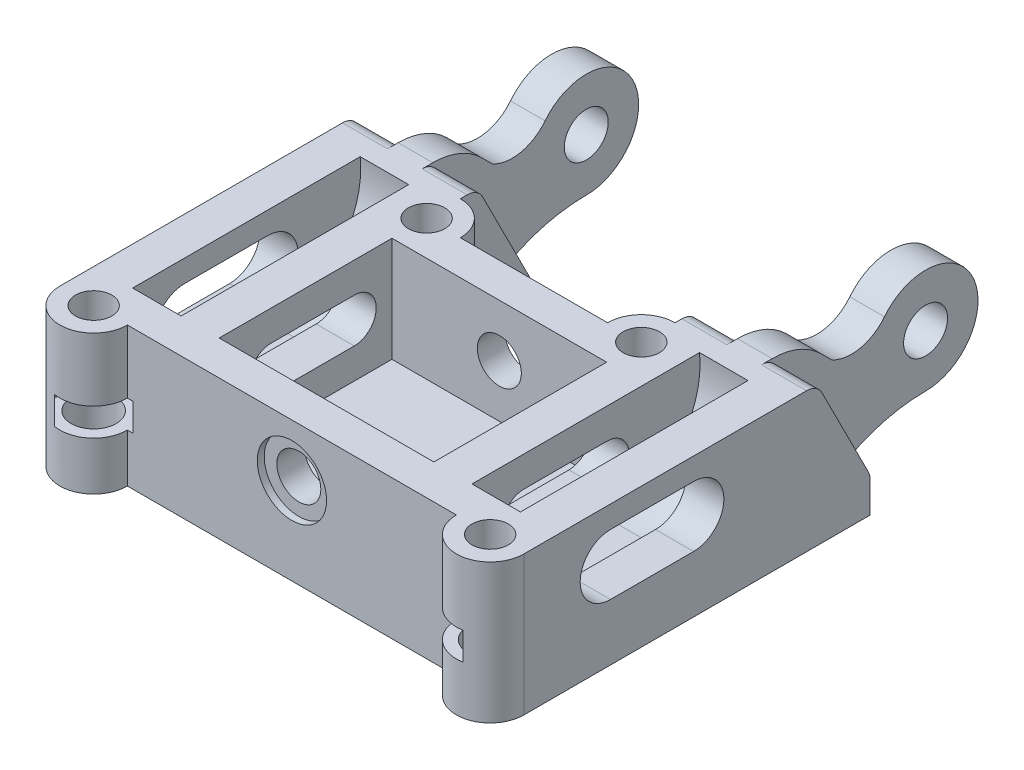
from build123d import *
from build123d.topology import SkipClean

# Parameters (mm, degrees)
SKETCH1_R                = 3.175
BOSS_EXTRUDE1_DEPTH      = 18
CUT_EXTRUDE4_DEPTH       = 3.5
CUT_EXTRUDE4_DEPTH_BACK  = 3.5
CUT_EXTRUDE5_DEPTH       = 6.5
SKETCH9_W                = 50
SKETCH9_H                = 5
BOSS_EXTRUDE2_DEPTH      = 15.5
FILLET8_R                = 2.5
BOSS_EXTRUDE3_REACH      = 75.76
SKETCH13_W               = 5
SKETCH13_H               = 15.14
SKETCH16_W               = 15.5
SKETCH16_H               = 5
BOSS_EXTRUDE4_DEPTH      = 15.14
CUT_EXTRUDE8_REACH       = 77.34
CUT_EXTRUDE9_DEPTH       = 5.5
CUT_EXTRUDE10_DEPTH      = 1
CUT_EXTRUDE11_START      = -1
SKETCH20_R               = 5
CUT_EXTRUDE11_DEPTH      = 1
SKETCH21_W               = 31
SKETCH21_H               = 15.05
CUT_EXTRUDE12_DEPTH      = 5
BOSS_EXTRUDE11_DEPTH     = 20.14
SKETCH31_R               = 2.125
CUT_EXTRUDE16_DEPTH      = 20.14
SKETCH38_R               = 3.25
CUT_EXTRUDE19_DEPTH      = 8
CUT_EXTRUDE21_DEPTH      = 3
CUT_EXTRUDE21_DEPTH_BACK = 1
SKETCH39_R               = 2.625
M5_CUT_DEPTH             = 9.14


with BuildPart() as part:
    # Sketch1 → Boss-Extrude1 (new body)
    with BuildSketch(Plane(origin=(0, 0, 0), x_dir=(0, 0, -1), z_dir=(1, 0, 0))):
        with BuildLine():
            Line((-64.5, -12.57), (-14.5, -12.57))
            ThreePointArc((-14.5, -12.57), (-7.668930825, -8.855100607), (0, -7.57))
            ThreePointArc((0, -7.57), (6.813585795, 3.298476711), (-5.937768577, 4.695508953))
            ThreePointArc((-5.937768577, 4.695508953), (-9.447591416, 2.520990205), (-13.536399337, 3.094608482))
            Line((-13.536399337, 3.094608482), (-15.082858667, 4.641067812))
            ThreePointArc((-15.082858667, 4.641067812), (-18.327092155, 6.808795325), (-22.153926479, 7.57))
            Line((-22.153926479, 7.57), (-24.481144331, 7.57))
            Line((-24.481144331, 7.57), (-64.5, 7.57))
            Line((-64.5, 7.57), (-64.5, -12.57))
        make_face()
        Circle(SKETCH1_R, mode=Mode.SUBTRACT)
        with BuildLine():
            Line((-52, 3.175), (-40, 3.175))
            ThreePointArc((-40, 3.175), (-36.825, 0), (-40, -3.175))
            Line((-40, -3.175), (-52, -3.175))
            ThreePointArc((-52, -3.175), (-55.175, 0), (-52, 3.175))
        make_face(mode=Mode.SUBTRACT)
    extrude(amount=BOSS_EXTRUDE1_DEPTH)

    # Sketch7 → Cut-Extrude4 (cut, two sides: drawn at the far end of the back side and taken through both)
    with BuildSketch(Plane.ZY.offset(-9).offset(-CUT_EXTRUDE4_DEPTH_BACK)):
        with BuildLine():
            Line((68.683555498, -7.57), (38.854158917, -7.57))
            ThreePointArc((38.854158917, -7.57), (29.611049041, -2.529814803), (26.6391325, 7.57))
            Line((26.6391325, 7.57), (68.683555498, 7.57))
            Line((68.683555498, 7.57), (68.683555498, -7.57))
        make_face()
    extrude(amount=CUT_EXTRUDE4_DEPTH + CUT_EXTRUDE4_DEPTH_BACK, mode=Mode.SUBTRACT)

    # Sketch8 → Cut-Extrude5 (cut)
    with BuildSketch(Plane(origin=(18, 0, 0), x_dir=(0, 0, -1), z_dir=(1, 0, 0))):
        Polygon((-14.5, -12.57), (-14.5, -7.57), (-22.153926479, 7.57), (4.247659324, 15.20685859), (9.411129334, 3.26000641), (7.386239134, -6.35822204), align=None)
    cut_extrude5 = extrude(amount=-CUT_EXTRUDE5_DEPTH, mode=Mode.SUBTRACT)

    # Sketch9 → Boss-Extrude2 (add)
    with BuildSketch(Plane.ZY):
        with Locations((39.5, -10.07)):
            Rectangle(SKETCH9_W, SKETCH9_H)
    extrude(amount=BOSS_EXTRUDE2_DEPTH)

    # Mirror2: Cut-Extrude5 across plane
    add(cut_extrude5.mirror(Plane.ZY.offset(-9)), mode=Mode.SUBTRACT)

    # Fillet8
    fillet8_edges = [part.edges().sort_by_distance(p)[0] for p in [
        (3.25, 7.57, 22.153926479),
        (14.75, 7.57, 22.153926479),
        (14.75, -7.57, 14.5),
    ]]
    fillet(fillet8_edges, radius=FILLET8_R)

    # Boss-Extrude3: up to this face of the body (flat: up to its plane)
    boss_extrude3_end = Plane(part.part.faces().sort_by_distance((-15.5, -10.07, 39.5))[0])
    # Sketch13 → Boss-Extrude3 (add, up to the picked face)
    with BuildSketch(Plane(origin=(18, 0, 0), x_dir=(0, 0, -1), z_dir=(1, 0, 0)), mode=Mode.PRIVATE) as boss_extrude3_sk1:
        with Locations((-62, 0)):
            Rectangle(SKETCH13_W, SKETCH13_H)
    boss_extrude3_tool1 = split(extrude(boss_extrude3_sk1.sketch, amount=-BOSS_EXTRUDE3_REACH, mode=Mode.PRIVATE), bisect_by=boss_extrude3_end, keep=Keep.BOTH, mode=Mode.PRIVATE)
    add(boss_extrude3_tool1.solids().sort_by(Axis((18, 0, 62), (-1, 0, 0)))[0])

    # Sketch16 → Boss-Extrude4 (add)
    with BuildSketch(Plane(origin=(0, -7.57, 0), x_dir=(1, 0, 0), z_dir=(0, 1, 0))):
        with Locations((-7.75, -32.05)):
            Rectangle(SKETCH16_W, SKETCH16_H)
    extrude(amount=BOSS_EXTRUDE4_DEPTH)

    # Cut-Extrude8: up to this face of the body (flat: up to its plane)
    cut_extrude8_end = Plane(part.part.faces().sort_by_distance((-7.75, 0, 29.55))[0])
    # Sketch14 → Cut-Extrude8 (cut, up to the picked face)
    with BuildSketch(Plane.XY.offset(64.5), mode=Mode.PRIVATE) as cut_extrude8_sk1:
        with BuildLine():
            Line((-15.5, 3.175), (-15.5, -3.175))
            ThreePointArc((-15.5, -3.175), (-12.325, 0), (-15.5, 3.175))
        make_face()
    cut_extrude8_tool1 = split(extrude(cut_extrude8_sk1.sketch, amount=-CUT_EXTRUDE8_REACH, mode=Mode.PRIVATE), bisect_by=cut_extrude8_end, keep=Keep.BOTH, mode=Mode.PRIVATE)
    add(cut_extrude8_tool1.solids().sort_by(Axis((-14.152488, 0, 64.5), (0, 0, -1)))[0], mode=Mode.SUBTRACT)

    # Sketch17 → Cut-Extrude9 (cut)
    with BuildSketch(Plane(origin=(18, 0, 0), x_dir=(0, 0, -1), z_dir=(1, 0, 0))):
        with BuildLine():
            Line((-40, -4.375), (-52, -4.375))
            ThreePointArc((-52, -4.375), (-56.375, 0), (-52, 4.375))
            Line((-52, 4.375), (-40, 4.375))
            ThreePointArc((-40, 4.375), (-35.625, 0), (-40, -4.375))
        make_face()
    extrude(amount=-CUT_EXTRUDE9_DEPTH, mode=Mode.SUBTRACT)

    # Sketch19 → Cut-Extrude10 (cut)
    with BuildSketch(Plane.XY.offset(64.5)):
        with BuildLine():
            Line((-15.5, 5), (-15.5, -5))
            ThreePointArc((-15.5, -5), (-10.5, 0), (-15.5, 5))
        make_face()
    extrude(amount=-CUT_EXTRUDE10_DEPTH, mode=Mode.SUBTRACT)

    # Sketch20 → Cut-Extrude11 (cut)
    with BuildSketch(Plane(origin=(0, 0, 29.55), x_dir=(-1, 0, 0), z_dir=(0, 0, -1)).offset(CUT_EXTRUDE11_START)):
        with Locations((15.5, 0)):
            Circle(SKETCH20_R)
    extrude(amount=CUT_EXTRUDE11_DEPTH, mode=Mode.SUBTRACT)

    # Mirror3: part across plane


with BuildPart() as part_1:
    with SkipClean():  # the faces are left unmerged after this step: merging them gives an invalid solid
        add(part.part)
        add(part.part.mirror(Plane(origin=(-15.5, 0, 0), x_dir=(0, 0, 1), z_dir=(1, 0, 0))))

    # Sketch21 → Cut-Extrude12 (cut)
    with SkipClean():  # the faces are left unmerged after this step: merging them gives an invalid solid
        with BuildSketch(Plane(origin=(0, -7.57, 0), x_dir=(1, 0, 0), z_dir=(0, 1, 0))):
            with Locations((-15.5, -22.025)):
                Rectangle(SKETCH21_W, SKETCH21_H)
        extrude(amount=-CUT_EXTRUDE12_DEPTH, mode=Mode.SUBTRACT)

    # Sketch30 → Boss-Extrude11 (add)
    with SkipClean():  # the faces are left unmerged after this step: merging them gives an invalid solid
        with BuildSketch(Plane(origin=(0, 7.57, 0), x_dir=(1, 0, 0), z_dir=(0, 1, 0))):
            with BuildLine():
                Line((0, -24.675), (0, -27.425))
                ThreePointArc((0, -27.425), (-1.50260191, -28.04739809), (-2.125, -29.55))
                Line((-2.125, -29.55), (-4.875, -29.55))
                ThreePointArc((-4.875, -29.55), (-3.447145558, -26.102854442), (0, -24.675))
            make_face()
            with BuildLine():
                Line((11, -64.5), (8.25, -64.5))
                ThreePointArc((8.25, -64.5), (13.125, -69.375), (18, -64.5))
                Line((18, -64.5), (15.25, -64.5))
                ThreePointArc((15.25, -64.5), (13.125, -66.625), (11, -64.5))
            make_face()
            with BuildLine():
                Line((-42, -64.5), (-39.25, -64.5))
                ThreePointArc((-39.25, -64.5), (-44.125, -69.375), (-49, -64.5))
                Line((-49, -64.5), (-46.25, -64.5))
                ThreePointArc((-46.25, -64.5), (-44.125, -66.625), (-42, -64.5))
            make_face()
        boss_extrude11 = extrude(amount=-BOSS_EXTRUDE11_DEPTH)

    # Sketch31 → Cut-Extrude16 (cut)
    with SkipClean():  # the faces are left unmerged after this step: merging them gives an invalid solid
        with BuildSketch(Plane(origin=(0, 7.57, 0), x_dir=(1, 0, 0), z_dir=(0, 1, 0))):
            with Locations(Location((0, -29.55, 0), (0, 0, 270))):
                Circle(SKETCH31_R)
            with Locations(Location((13.125, -64.5, 0), (0, 0, 270))):
                Circle(SKETCH31_R)
            with Locations(Location((-44.125, -64.5, 0), (0, 0, 270))):
                Circle(SKETCH31_R)
        cut_extrude16 = extrude(amount=-CUT_EXTRUDE16_DEPTH, mode=Mode.SUBTRACT)

    # Mirror4: Boss-Extrude11, Cut-Extrude16 across plane
    with SkipClean():  # the faces are left unmerged after this step: merging them gives an invalid solid
        add(boss_extrude11.mirror(Plane(origin=(-15.5, 0, 0), x_dir=(0, 0, 1), z_dir=(1, 0, 0))))
        add(cut_extrude16.mirror(Plane(origin=(-15.5, 0, 0), x_dir=(0, 0, 1), z_dir=(1, 0, 0))), mode=Mode.SUBTRACT)

    # Sketch38 → Cut-Extrude19 (cut)
    with SkipClean():  # the faces are left unmerged after this step: merging them gives an invalid solid
        with BuildSketch(Plane.XZ.offset(12.57)):
            with Locations(Location((-31, 29.55, 0), (0, 0, 270))):
                Circle(SKETCH38_R)
            with Locations(Location((0, 29.55, 0), (0, 0, 270))):
                Circle(SKETCH38_R)
            with Locations(Location((13.125, 64.5, 0), (0, 0, 270))):
                Circle(SKETCH38_R)
            with Locations(Location((-44.125, 64.5, 0), (0, 0, 270))):
                Circle(SKETCH38_R)
        extrude(amount=-CUT_EXTRUDE19_DEPTH, mode=Mode.SUBTRACT)

    # Sketch32 → Cut-Extrude21 (cut, two sides: drawn at the far end of the back side and taken through both)
    with SkipClean():  # the faces are left unmerged after this step: merging them gives an invalid solid
        with BuildSketch(Plane.XZ.offset(2.57).offset(-CUT_EXTRUDE21_DEPTH_BACK)):
            Polygon((-26.154818283, 22.133830878), (-22.154818283, 29.062034108), (-31, 34.168802154), (-35, 31.859401077), (-35, 27.240598923), align=None)
            Polygon((11.929566037, 60.038579713), (8.663579713, 63.304566037), (2.173721464, 69.777896049), (7.838839832, 75.443014417), (14.320433963, 68.961420287), (17.586420287, 65.695433963), (16.390986324, 61.234013676), align=None)
            Polygon((-45.320433963, 68.961420287), (-48.586420287, 65.695433963), (-47.390986324, 61.234013676), (-42.929566037, 60.038579713), (-39.663579713, 63.304566037), (-33.173721464, 69.777896049), (-38.838839832, 75.443014417), align=None)
            Polygon((4, 27.240598923), (-4.845181717, 22.133830878), (-8.845181717, 29.062034108), (0, 34.168802154), (4, 31.859401077), align=None)
        extrude(amount=CUT_EXTRUDE21_DEPTH + CUT_EXTRUDE21_DEPTH_BACK, mode=Mode.SUBTRACT)

    # Sketch39 → M5_Cut (cut)
    with SkipClean():  # the faces are left unmerged after this step: merging them gives an invalid solid
        with BuildSketch(Plane(origin=(0, 7.57, 0), x_dir=(1, 0, 0), z_dir=(0, 1, 0))):
            with Locations(Location((-31, -29.55, 0), (0, 0, 270))):
                Circle(SKETCH39_R)
            with Locations(Location((0, -29.55, 0), (0, 0, 270))):
                Circle(SKETCH39_R)
            with Locations(Location((13.125, -64.5, 0), (0, 0, 270))):
                Circle(SKETCH39_R)
            with Locations(Location((-44.125, -64.5, 0), (0, 0, 270))):
                Circle(SKETCH39_R)
        extrude(amount=-M5_CUT_DEPTH, mode=Mode.SUBTRACT)


solid = part_1.part
